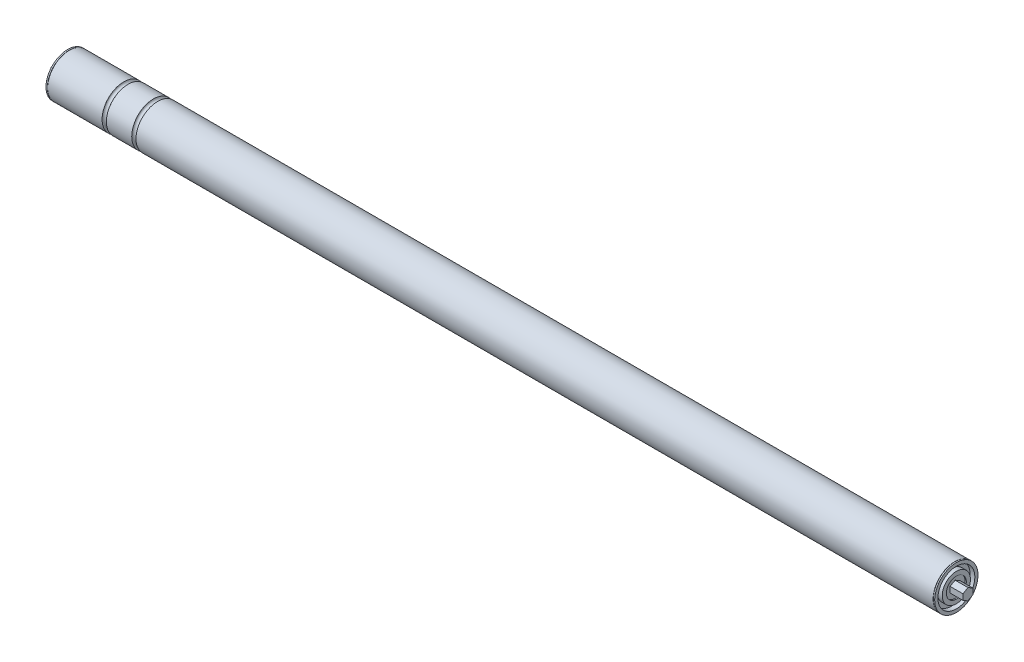
from build123d import *

# Parameters (mm, degrees)
BOSS_EXTRUDE1_START             = -487.984875
SKETCH3_R                       = 24.13
BOSS_EXTRUDE1_DEPTH             = 975.96975
CHAMFER1_SIZE                   = 0.254
BOSS_EXTRUDE3_REACH             = 985.674
SKETCH6_R                       = 24.13
SKETCH6_R_2                     = 22.352
BOSS_EXTRUDE3_DIRECTION_2_REACH = 985.674
BOSS_EXTRUDE2_DEPTH             = 508
BOSS_EXTRUDE2_DEPTH_BACK        = 508
LPATTERN1_COUNT                 = 2
LPATTERN1_PITCH                 = 33.02


with BuildPart() as part:
    # Sketch2 → Revolve1 (revolve)
    with BuildSketch(Plane.XY, mode=Mode.PRIVATE) as revolve1_sk:
        Polygon((-493.7125, 0), (-493.7125, 11.1125), (-495.096875, 11.1125), (-495.096875, 15.712927565), (-489.762875, 15.712927565), (-489.762875, 20.574), (-495.096875, 20.574), (-495.096875, 24.13), (-493.318875, 24.13), (-493.318875, 22.352), (-487.984875, 22.352), (-487.984875, 0), align=None)
    revolve(revolve1_sk.sketch.rotate(Axis((-493.7125, 0, 0), (1, 0, 0)), 180), axis=Axis((-493.7125, 0, 0), (1, 0, 0)))


with BuildPart() as body_2:
    # Mirror2: mirrored copy
    add(part.part.mirror(Plane(origin=(0, 0, 0), x_dir=(0, 0, 1), z_dir=(1, 0, 0))))


with BuildPart() as part_1:
    add(part.part)

    add(body_2.part)  # Boss-Extrude1 merges body 2
    # Sketch3 → Boss-Extrude1 (add)
    with BuildSketch(Plane(origin=(0, 0, 0), x_dir=(0, 0, -1), z_dir=(1, 0, 0)).offset(BOSS_EXTRUDE1_START)):
        with Locations(Location((0, 0, 0), (0, 0, 270))):
            Circle(SKETCH3_R)
    extrude(amount=BOSS_EXTRUDE1_DEPTH)

    # Chamfer1
    chamfer1_edges = [part_1.edges().sort_by_distance(p)[0] for p in [
        (493.318875, 24.13, 0),
        (-493.318875, 24.13, 0),
    ]]
    chamfer(chamfer1_edges, length=CHAMFER1_SIZE)

    # Boss-Extrude3: up to this face of the body (flat: up to its plane)
    boss_extrude3_end = Plane(part_1.part.faces().sort_by_distance((-493.318875, 23.20068474, 0))[0])
    # Sketch6 → Boss-Extrude3 (add, up to the picked face)
    with BuildSketch(Plane.ZY.offset(487.984875), mode=Mode.PRIVATE) as boss_extrude3_sk1:
        with Locations(Location((0, 0, 0), (0, 0, 270))):
            Circle(SKETCH6_R)
        Circle(SKETCH6_R_2, mode=Mode.SUBTRACT)
    boss_extrude3_tool1 = split(extrude(boss_extrude3_sk1.sketch, amount=BOSS_EXTRUDE3_REACH, mode=Mode.PRIVATE), bisect_by=boss_extrude3_end, keep=Keep.BOTH, mode=Mode.PRIVATE)
    add(boss_extrude3_tool1.solids().sort_by(Axis((-487.984875, 23.447501, 0), (-1, 0, 0)))[0])

    # Boss-Extrude3 direction 2: up to this face of the body (flat: up to its plane)
    boss_extrude3_direction_2_end = Plane(part_1.part.faces().sort_by_distance((493.318875, 23.20068474, 0))[0])
    # Sketch6 → Boss-Extrude3 direction 2 (add, up to the picked face)
    with BuildSketch(Plane.ZY.offset(487.984875), mode=Mode.PRIVATE) as boss_extrude3_direction_2_sk1:
        with Locations(Location((0, 0, 0), (0, 0, 270))):
            Circle(SKETCH6_R)
        Circle(SKETCH6_R_2, mode=Mode.SUBTRACT)
    boss_extrude3_direction_2_tool1 = split(extrude(boss_extrude3_direction_2_sk1.sketch, amount=-BOSS_EXTRUDE3_DIRECTION_2_REACH, mode=Mode.PRIVATE), bisect_by=boss_extrude3_direction_2_end, keep=Keep.BOTH, mode=Mode.PRIVATE)
    add(boss_extrude3_direction_2_tool1.solids().sort_by(Axis((-487.984875, 23.447501, 0), (1, 0, 0)))[0])

    # Sketch4 → Boss-Extrude2 (add, two sides: drawn at the far end of the back side and taken through both)
    with BuildSketch(Plane(origin=(0, 0, 0), x_dir=(0, 0, -1), z_dir=(1, 0, 0)).offset(-BOSS_EXTRUDE2_DEPTH_BACK)):
        Polygon((0, 6.415804866), (-5.55625, 3.207902433), (-5.55625, -3.207902433), (0, -6.415804866), (5.55625, -3.207902433), (5.55625, 3.207902433), align=None)
    extrude(amount=BOSS_EXTRUDE2_DEPTH + BOSS_EXTRUDE2_DEPTH_BACK)

    # Sketch5 → Cut-Revolve1 (revolve, cut)
    with BuildSketch(Plane.XY, mode=Mode.PRIVATE) as cut_revolve1_sk:
        with BuildLine():
            Line((-433.38115, 24.8874), (-433.38115, 25.5224))
            Line((-433.38115, 25.5224), (-427.04385, 25.5224))
            Line((-427.04385, 25.5224), (-427.04385, 24.8874))
            ThreePointArc((-427.04385, 24.8874), (-427.60062588, 24.65677588), (-427.83125, 24.1))
            ThreePointArc((-427.83125, 24.1), (-430.2125, 21.71875), (-432.59375, 24.1))
            ThreePointArc((-432.59375, 24.1), (-432.82437412, 24.65677588), (-433.38115, 24.8874))
        make_face()
    cut_revolve1 = revolve(cut_revolve1_sk.sketch.rotate(Axis((-508, 0, 0), (1, 0, 0)), 180), axis=Axis((-508, 0, 0), (1, 0, 0)), mode=Mode.SUBTRACT)

    # LPattern1: Cut-Revolve1 ×2
    with Locations(*[(i * LPATTERN1_PITCH, 0, 0) for i in range(1, LPATTERN1_COUNT)]):
        add(cut_revolve1, mode=Mode.SUBTRACT)


solid = part_1.part
